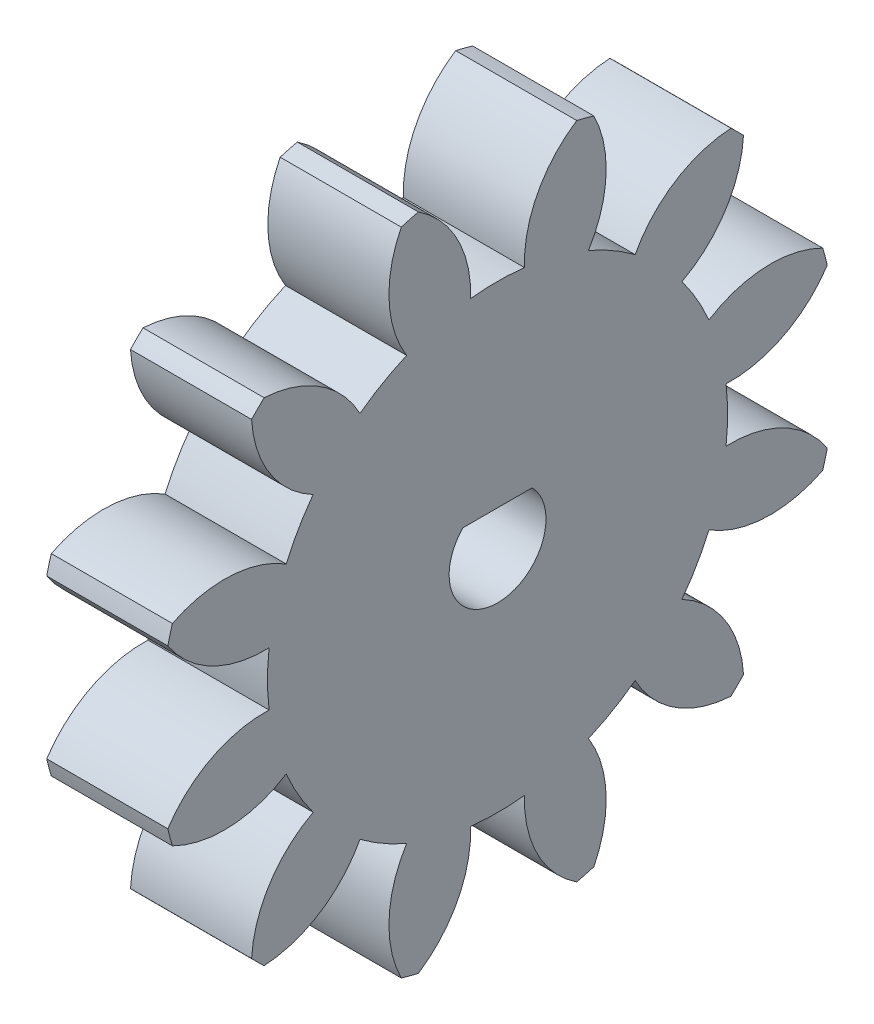
from build123d import *

# Parameters (mm, degrees)
BASPROSKE_W         = 5
BASPROSKE_H         = 14
TOOTHCUT_DEPTH      = 21.420577857
TEETHCUTS_COUNT     = 12
TEETHCUTS_ANGLE     = 330
BORSKE_R            = 2
BORE_DEPTH          = 50.0000508
BOSS_EXTRUDE1_DEPTH = 5


with BuildPart() as part:
    # BasProSke → Base-Revolve (revolve)
    with BuildSketch(Plane(origin=(0, 0, 0), x_dir=(1, 0, 0), z_dir=(0, 1, 0)), mode=Mode.PRIVATE) as base_revolve_sk:
        with Locations((2.5, 7)):
            Rectangle(BASPROSKE_W, BASPROSKE_H)
    revolve(base_revolve_sk.sketch.rotate(Axis((-10, 0, 0), (1, 0, 0)), 180), axis=Axis((-10, 0, 0), (1, 0, 0)))

    # TooCutSke → ToothCut (cut, through all)
    with BuildSketch(Plane(origin=(0, 0, 0), x_dir=(0, 0, -1), z_dir=(1, 0, 0))):
        with BuildLine():
            ThreePointArc((1.111908866, 9.433698091), (0, 9.499), (-1.111908866, 9.433698091))
            ThreePointArc((-1.111908866, 9.433698091), (-1.651516138, 11.821129337), (-3.298149691, 13.632096456))
            ThreePointArc((-3.298149691, 13.632096456), (0, 14.0254), (3.298149691, 13.632096456))
            ThreePointArc((3.298149691, 13.632096456), (1.651516138, 11.821129337), (1.111908866, 9.433698091))
        make_face()
    toothcut = extrude(amount=TOOTHCUT_DEPTH, mode=Mode.SUBTRACT)

    # TeethCuts: ToothCut ×12 about axis
    teethcuts_axis = Axis((-10, 0, 0), (1, 0, 0))
    for i in range(1, TEETHCUTS_COUNT):
        add(toothcut.rotate(teethcuts_axis, i * TEETHCUTS_ANGLE / (TEETHCUTS_COUNT - 1)), mode=Mode.SUBTRACT)

    # BorSke → Bore (cut, symmetric)
    with BuildSketch(Plane(origin=(0, 0, 0), x_dir=(0, 0, -1), z_dir=(1, 0, 0))):
        with Locations(Location((0, 0, 0), (0, 0, 180))):
            Circle(BORSKE_R)
    extrude(amount=BORE_DEPTH, both=True, mode=Mode.SUBTRACT)

    # Sketch2 → Boss-Extrude1 (add)
    with BuildSketch(Plane(origin=(5, 0, 0), x_dir=(0, 0, -1), z_dir=(1, 0, 0))):
        with BuildLine():
            Line((-1.428285686, 1.4), (1.428285686, 1.4))
            ThreePointArc((1.428285686, 1.4), (0, 2), (-1.428285686, 1.4))
        make_face()
    extrude(amount=-BOSS_EXTRUDE1_DEPTH)


solid = part.part
